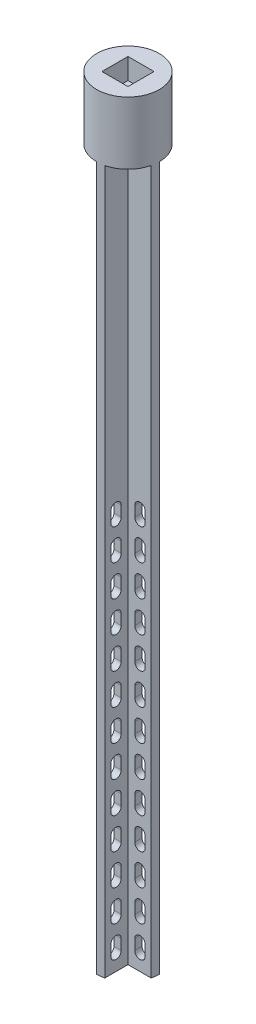
from build123d import *

# Parameters (mm, degrees)
EXTRUDE_1_DEPTH        = 700
EXTRUDE_1_2_DEPTH      = 20
EXTRUDE_1_2_DEPTH_BACK = 20
SKETCH_2_R             = 30
EXTRUDE_START          = 20
SKETCH_3_R             = 30
SKETCH_3_W             = 25
SKETCH_3_H             = 25
EXTRUDE_2_DEPTH        = 20
CUT_EXTRUDE_1_DEPTH    = 742.531523268
PATTERN_LINEAR_1_COUNT = 13
PATTERN_LINEAR_1_PITCH = 30
CUT_EXTRUDE_2_DEPTH    = 742.531523268
PATTERN_LINEAR_2_COUNT = 13
PATTERN_LINEAR_2_PITCH = 30
CUT_EXTRUDE_3_DEPTH    = 5
SKETCH_11_OUTSIDE_W    = 209.976
SKETCH_11_OUTSIDE_H    = 209.976
SKETCH_11_OUTSIDE_R    = 30
CUT_EXTRUDE_4_DEPTH    = 735


with BuildPart() as part:
    # 草图1 → Extrude 1 (new body)
    with BuildSketch(Plane(origin=(0, 0, 0), x_dir=(1, 0, 0), z_dir=(0, 1, 0))):
        Polygon((30, 0), (0, 0), (0, -30), (7, -30), (7, -7), (30, -7), align=None)
    extrude(amount=EXTRUDE_1_DEPTH)

    # 草图2 → Extrude 1 2 (add, two sides: drawn at the far end of the back side and taken through both)
    with BuildSketch(Plane(origin=(0, 700, 0), x_dir=(1, 0, 0), z_dir=(0, 1, 0)).offset(-EXTRUDE_1_2_DEPTH_BACK)):
        with Locations(Location((0, 0, 0), (0, 0, 270))):
            Circle(SKETCH_2_R)
    extrude(amount=EXTRUDE_1_2_DEPTH + EXTRUDE_1_2_DEPTH_BACK)

    # 草图3 → 凸台-拉伸2 (add)
    with BuildSketch(Plane(origin=(0, 720, 0), x_dir=(1, 0, 0), z_dir=(0, 1, 0)).offset(EXTRUDE_START)):
        with Locations(Location((0, 0, 0), (0, 0, 270))):
            Circle(SKETCH_3_R)
        Rectangle(SKETCH_3_W, SKETCH_3_H, mode=Mode.SUBTRACT)
    extrude(amount=-EXTRUDE_2_DEPTH)

    # 草图6 → 切除-拉伸1 (cut, through all)
    with BuildSketch(Plane.XY.offset(7)):
        with BuildLine():
            Line((23.5, 30), (23.5, 20))
            ThreePointArc((23.5, 20), (18.5, 15), (13.5, 20))
            Line((13.5, 20), (13.5, 30))
            ThreePointArc((13.5, 30), (18.5, 35), (23.5, 30))
        make_face()
    cut_extrude_1 = extrude(amount=-CUT_EXTRUDE_1_DEPTH, mode=Mode.SUBTRACT)

    # 阵列(线性)1: 切除-拉伸1 ×13
    with Locations(*[(0, i * PATTERN_LINEAR_1_PITCH, 0) for i in range(1, PATTERN_LINEAR_1_COUNT)]):
        add(cut_extrude_1, mode=Mode.SUBTRACT)

    # 草图7 → 切除-拉伸2 (cut, through all)
    with BuildSketch(Plane(origin=(7, 0, 0), x_dir=(0, 0, -1), z_dir=(1, 0, 0))):
        with BuildLine():
            Line((-23.5, 20), (-23.5, 30))
            ThreePointArc((-23.5, 30), (-18.5, 35), (-13.5, 30))
            Line((-13.5, 30), (-13.5, 20))
            ThreePointArc((-13.5, 20), (-18.5, 15), (-23.5, 20))
        make_face()
    cut_extrude_2 = extrude(amount=-CUT_EXTRUDE_2_DEPTH, mode=Mode.SUBTRACT)

    # 阵列(线性)2: 切除-拉伸2 ×13
    with Locations(*[(0, i * PATTERN_LINEAR_2_PITCH, 0) for i in range(1, PATTERN_LINEAR_2_COUNT)]):
        add(cut_extrude_2, mode=Mode.SUBTRACT)

    # 草图8 → 切除-拉伸3 (cut)
    with BuildSketch(Plane.XZ):
        Polygon((30, 7), (7, 7), (7, 30), (0, 30), (0, 0), (30, 0), align=None)
    extrude(amount=-CUT_EXTRUDE_3_DEPTH, mode=Mode.SUBTRACT)

    # 草图11 outside → 切除-拉伸4 (cut)
    with BuildSketch(Plane(origin=(0, 740, 0), x_dir=(1, 0, 0), z_dir=(0, 1, 0))):
        Rectangle(SKETCH_11_OUTSIDE_W, SKETCH_11_OUTSIDE_H)
        with Locations(Location((0, 0, 0), (0, 0, 270))):
            Circle(SKETCH_11_OUTSIDE_R, mode=Mode.SUBTRACT)
    extrude(amount=-CUT_EXTRUDE_4_DEPTH, mode=Mode.SUBTRACT)


solid = part.part
